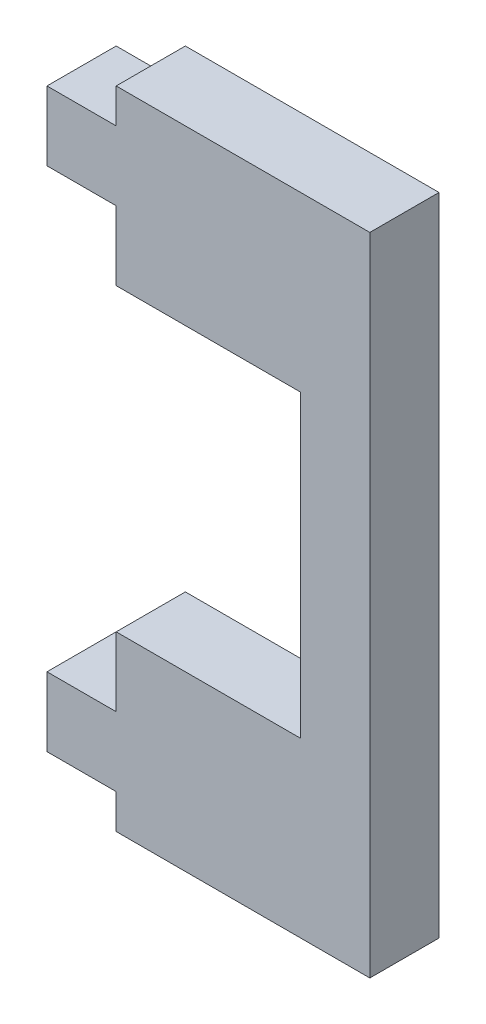
from build123d import *

# Parameters (mm, degrees)
SALIENTE_EXTRUIR1_DEPTH = 3


with BuildPart() as part:
    # Croquis1 → Saliente-Extruir1 (new body)
    with BuildSketch(Plane.XY):
        Polygon((-8, 12.5), (-11, 12.5), (-11, 9.5), (-8, 9.5), (-8, 6.5), (0, 6.5), (0, 0), (3, 0), (3, 14), (-8, 14), align=None)
    saliente_extruir1 = extrude(amount=SALIENTE_EXTRUIR1_DEPTH)

    # Simetría1: Saliente-Extruir1 across plane
    add(saliente_extruir1.mirror(Plane(origin=(0, 0, 3), x_dir=(0, 0, 1), z_dir=(0, 1, 0))))


solid = part.part
